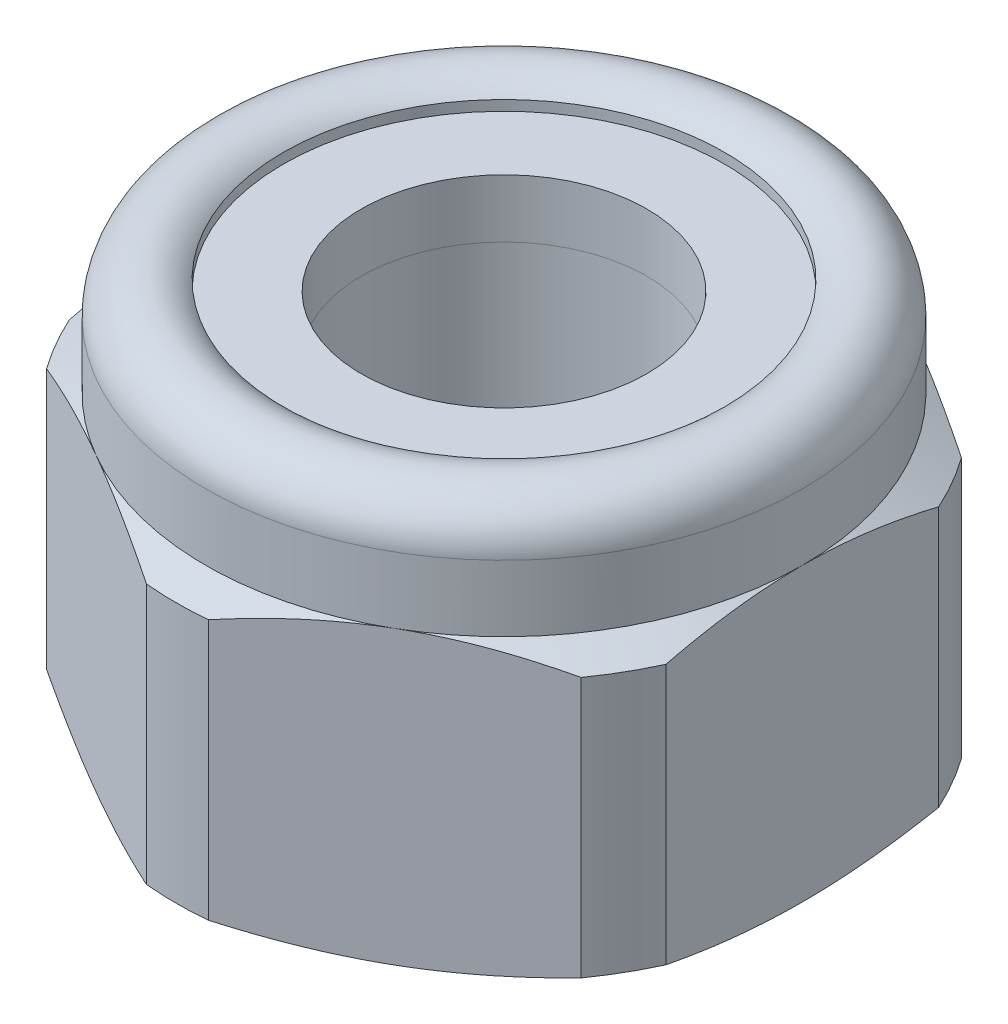
from build123d import *

# Parameters (mm, degrees)
BOSS_EXTRUDE1_DEPTH      = 4.3688
BOSS_EXTRUDE1_DEPTH_BACK = 4.3688
SKETCH2_R                = 3.052206448
SKETCH4_W                = 1.661596776
SKETCH4_H                = 1.243995064
SKETCH11_OUTSIDE_W       = 19.02
SKETCH11_OUTSIDE_H       = 20.994
SKETCH11_OUTSIDE_R       = 7.0104
CUT_EXTRUDE1_DEPTH       = 14.083794639


with BuildPart() as part:
    # Sketch2 → Boss-Extrude1 (new, two sides: drawn at the far end of the back side and taken through both)
    with BuildSketch(Plane(origin=(0, 0, 0), x_dir=(1, 0, 0), z_dir=(0, 1, 0)).offset(-BOSS_EXTRUDE1_DEPTH_BACK)):
        Polygon((0, 7.361677812), (-6.3754, 3.680838906), (-6.3754, -3.680838906), (0, -7.361677812), (6.3754, -3.680838906), (6.3754, 3.680838906), align=None)
        with Locations(Location((0, 0, 0), (0, 0, 270))):
            Circle(SKETCH2_R, mode=Mode.SUBTRACT)
    extrude(amount=BOSS_EXTRUDE1_DEPTH + BOSS_EXTRUDE1_DEPTH_BACK)

    # Sketch3 → Cut-Revolve2 (revolve, cut)
    with BuildSketch(Plane(origin=(0, 0, 0), x_dir=(0, 0, -1), z_dir=(1, 0, 0)), mode=Mode.PRIVATE) as cut_revolve2_sk:
        with BuildLine():
            Line((7.361677812, 1.9812), (7.361677812, 5.3688))
            Line((7.361677812, 5.3688), (3.052206448, 5.3688))
            Line((3.052206448, 5.3688), (3.052206448, 2.62128))
            Line((3.052206448, 2.62128), (4.713803224, 2.62128))
            Line((4.713803224, 2.62128), (4.713803224, 4.083715064))
            ThreePointArc((4.713803224, 4.083715064), (5.774540563, 4.294708839), (6.3754, 3.395459144))
            Line((6.3754, 3.395459144), (6.3754, 1.9812))
            Line((6.3754, 1.9812), (7.361677812, 1.402375189))
            Line((7.361677812, 1.402375189), (7.361677812, 1.9812))
        make_face()
        Polygon((6.120384, -4.3688), (7.361677812, -3.789975189), (7.361677812, -4.3688), align=None)
        Polygon((3.052206448, -4.3688), (3.052206448, -3.57505), (3.845956448, -4.3688), align=None)
    revolve(cut_revolve2_sk.sketch.rotate(Axis((0, -4.3688, 0), (0, 1, 0)), 270), axis=Axis((0, -4.3688, 0), (0, 1, 0)), mode=Mode.SUBTRACT)

    # Sketch11 outside → Cut-Extrude1 (cut, through all)
    with BuildSketch(Plane.XZ.offset(4.3688)):
        Rectangle(SKETCH11_OUTSIDE_W, SKETCH11_OUTSIDE_H)
        Circle(SKETCH11_OUTSIDE_R, mode=Mode.SUBTRACT)
    extrude(amount=-CUT_EXTRUDE1_DEPTH, mode=Mode.SUBTRACT)


with BuildPart() as body_2:
    # Sketch4 → Revolve1 (revolve)
    with BuildSketch(Plane(origin=(0, 0, 0), x_dir=(0, 0, -1), z_dir=(1, 0, 0)), mode=Mode.PRIVATE) as revolve1_sk:
        with Locations((-3.883004836, 3.243277532)):
            Rectangle(SKETCH4_W, SKETCH4_H)
    revolve(revolve1_sk.sketch.rotate(Axis((0, -4.3688, 0), (0, 1, 0)), 90), axis=Axis((0, -4.3688, 0), (0, 1, 0)))


solid = Compound([part.part, body_2.part])
